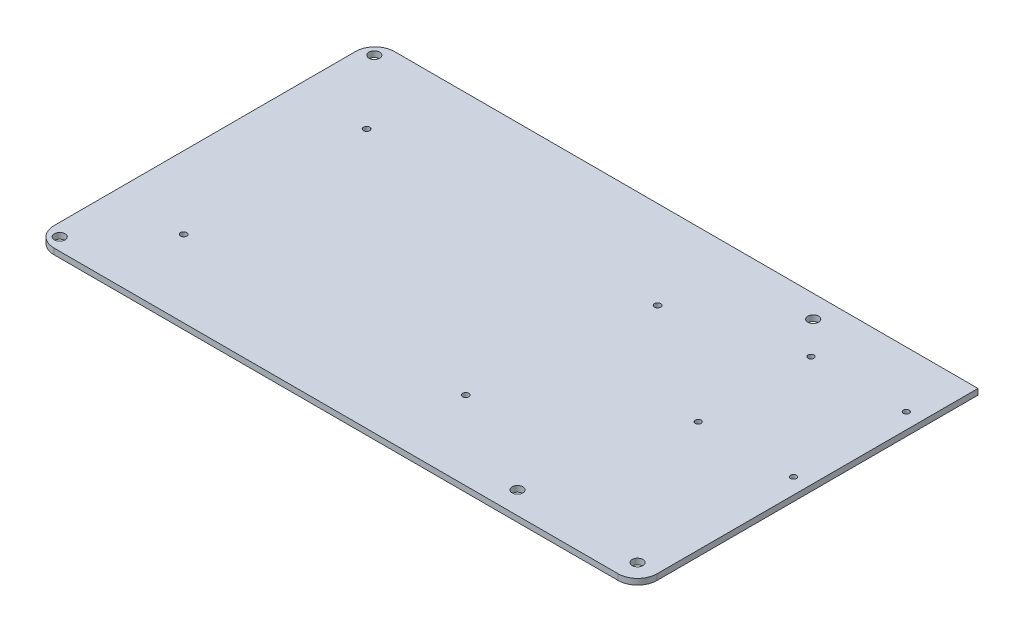
from build123d import *

# Parameters (mm, degrees)
ESQUISSE1_R        = 2.75
ESQUISSE1_R_2      = 1.5
BOSS_EXTRU_1_DEPTH = 3
SKETCH1_R          = 1.6
CUT_EXTRUDE9_DEPTH = 10


with BuildPart() as part:
    # Esquisse1 → Boss.-Extru.1 (new body)
    with BuildSketch(Plane(origin=(0, 0, 0), x_dir=(1, 0, 0), z_dir=(0, 1, 0))):
        with BuildLine():
            Line((-145, 87.5), (155, 87.5))
            Line((155, 87.5), (155, -77.5))
            ThreePointArc((155, -77.5), (152.071067812, -84.571067812), (145, -87.5))
            Line((145, -87.5), (-145, -87.5))
            ThreePointArc((-145, -87.5), (-152.071067812, -84.571067812), (-155, -77.5))
            Line((-155, -77.5), (-155, 77.5))
            ThreePointArc((-155, 77.5), (-152.071067812, 84.571067812), (-145, 87.5))
        make_face()
        with Locations(Location((81.78624341, 76, 0), (0, 0, 270))):
            Circle(ESQUISSE1_R, mode=Mode.SUBTRACT)
        with Locations(Location((97.920945316, 58.728751177, 0), (0, 0, 270))):
            Circle(ESQUISSE1_R_2, mode=Mode.SUBTRACT)
        with Locations(Location((-148.535533906, 80.692777163, 0), (0, 0, 270))):
            Circle(ESQUISSE1_R, mode=Mode.SUBTRACT)
        with Locations(Location((-148.535533906, -81.035533906, 0), (0, 0, 270))):
            Circle(ESQUISSE1_R, mode=Mode.SUBTRACT)
        with Locations(Location((146.920945316, 58.728751177, 0), (0, 0, 270))):
            Circle(ESQUISSE1_R_2, mode=Mode.SUBTRACT)
        with Locations(Location((97.920945316, 0.728751177, 0), (0, 0, 270))):
            Circle(ESQUISSE1_R_2, mode=Mode.SUBTRACT)
        with Locations(Location((146.920945316, 0.728751177, 0), (0, 0, 270))):
            Circle(ESQUISSE1_R_2, mode=Mode.SUBTRACT)
        with Locations(Location((81.78624341, -76, 0), (0, 0, 270))):
            Circle(ESQUISSE1_R, mode=Mode.SUBTRACT)
        with Locations(Location((145, -77.5, 0), (0, 0, 270))):
            Circle(ESQUISSE1_R, mode=Mode.SUBTRACT)
    extrude(amount=BOSS_EXTRU_1_DEPTH)

    # Sketch1 → Cut-Extrude9 (cut)
    with BuildSketch(Plane(origin=(0, 3, 0), x_dir=(1, 0, 0), z_dir=(0, 1, 0))):
        with Locations(Location((35.668507743, 42.141960397, 0), (0, 0, 270))):
            Circle(SKETCH1_R)
        with Locations(Location((26.275656472, -47.123541034, 0), (0, 0, 270))):
            Circle(SKETCH1_R)
        with Locations(Location((-117.787345368, -48.053575675, 0), (0, 0, 270))):
            Circle(SKETCH1_R)
        with Locations(Location((-117.697345367, 45.896424322, 0), (0, 0, 270))):
            Circle(SKETCH1_R)
    extrude(amount=-CUT_EXTRUDE9_DEPTH, mode=Mode.SUBTRACT)


solid = part.part
